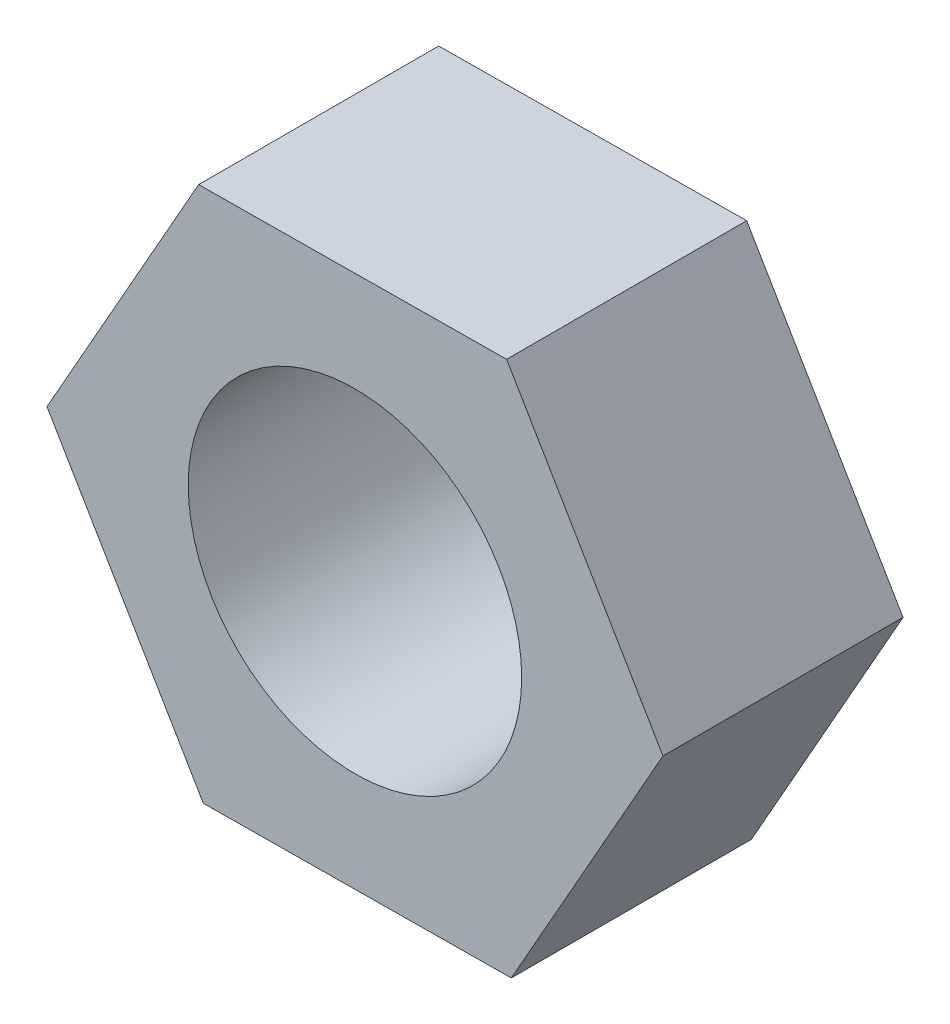
from build123d import *

# Parameters (mm, degrees)
SKETCH_1_R      = 2.5
EXTRUDE_1_DEPTH = 3.6


with BuildPart() as part:
    # 草图1 → 凸台-拉伸1 (new body)
    with BuildSketch(Plane.XY):
        Polygon((2.344521426, -3.979516631), (4.61862321, 0.040656799), (2.274101784, 4.02017343), (-2.344521426, 3.979516631), (-4.61862321, -0.040656799), (-2.274101784, -4.02017343), align=None)
        Circle(SKETCH_1_R, mode=Mode.SUBTRACT)
    extrude(amount=EXTRUDE_1_DEPTH)


solid = part.part
